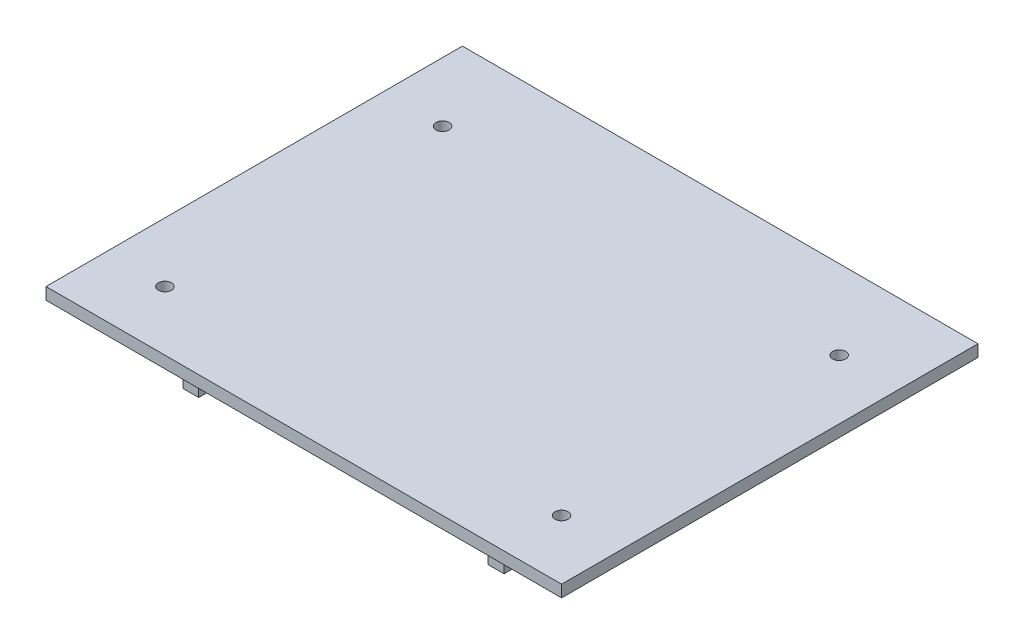
from build123d import *

# Parameters (mm, degrees)
SKETCH_1_W         = 130
SKETCH_1_H         = 105
F_3MM_DEPTH        = 3
SKETCH_2_W         = 4
SKETCH_2_H         = 91
F_12MM_DEPTH       = 12
SKETCH_3_R         = 1.65
F_3P3MM_DEPTH      = 142.149743181
SKETCH_4_R         = 1.65
CUT_EXTRUDE1_DEPTH = 115.450862819


with BuildPart() as part:
    # 草图1 → 支架连接板_3mm (new body)
    with BuildSketch(Plane(origin=(0, 0, 0), x_dir=(1, 0, 0), z_dir=(0, 1, 0))):
        with Locations((0, -40.5)):
            Rectangle(SKETCH_1_W, SKETCH_1_H)
    extrude(amount=F_3MM_DEPTH)

    # 草图2 → 左右导轨_12mm (add)
    with BuildSketch(Plane(origin=(0, 0, 0), x_dir=(1, 0, 0), z_dir=(0, 1, 0))):
        with Locations((-38.5, -37.5)):
            Rectangle(SKETCH_2_W, SKETCH_2_H)
        with Locations((38.5, -37.5)):
            Rectangle(SKETCH_2_W, SKETCH_2_H)
    extrude(amount=-F_12MM_DEPTH)

    # 草图3 → 左右铰接孔及滑槽_3p3mm (cut, through all)
    with BuildSketch(Plane(origin=(40.5, 0, 0), x_dir=(0, 0, -1), z_dir=(1, 0, 0))):
        with Locations((0, -5.5)):
            Circle(SKETCH_3_R)
        with BuildLine():
            Line((-20.48913575, -7.15), (-72.18913575, -7.15))
            ThreePointArc((-72.18913575, -7.15), (-73.83913575, -5.5), (-72.18913575, -3.85))
            Line((-72.18913575, -3.85), (-20.48913575, -3.85))
            ThreePointArc((-20.48913575, -3.85), (-18.83913575, -5.5), (-20.48913575, -7.15))
        make_face()
    extrude(amount=-F_3P3MM_DEPTH, mode=Mode.SUBTRACT)

    # 草图4 → Cut-Extrude1 (cut, through all)
    with BuildSketch(Plane(origin=(0, 3, 0), x_dir=(1, 0, 0), z_dir=(0, 1, 0))):
        with Locations(Location((-50, -8, 0), (0, 0, 270))):
            Circle(SKETCH_4_R)
        with Locations(Location((-50, -78, 0), (0, 0, 270))):
            Circle(SKETCH_4_R)
        with Locations(Location((50, -8, 0), (0, 0, 270))):
            Circle(SKETCH_4_R)
        with Locations(Location((50, -78, 0), (0, 0, 270))):
            Circle(SKETCH_4_R)
    extrude(amount=-CUT_EXTRUDE1_DEPTH, mode=Mode.SUBTRACT)


solid = part.part
